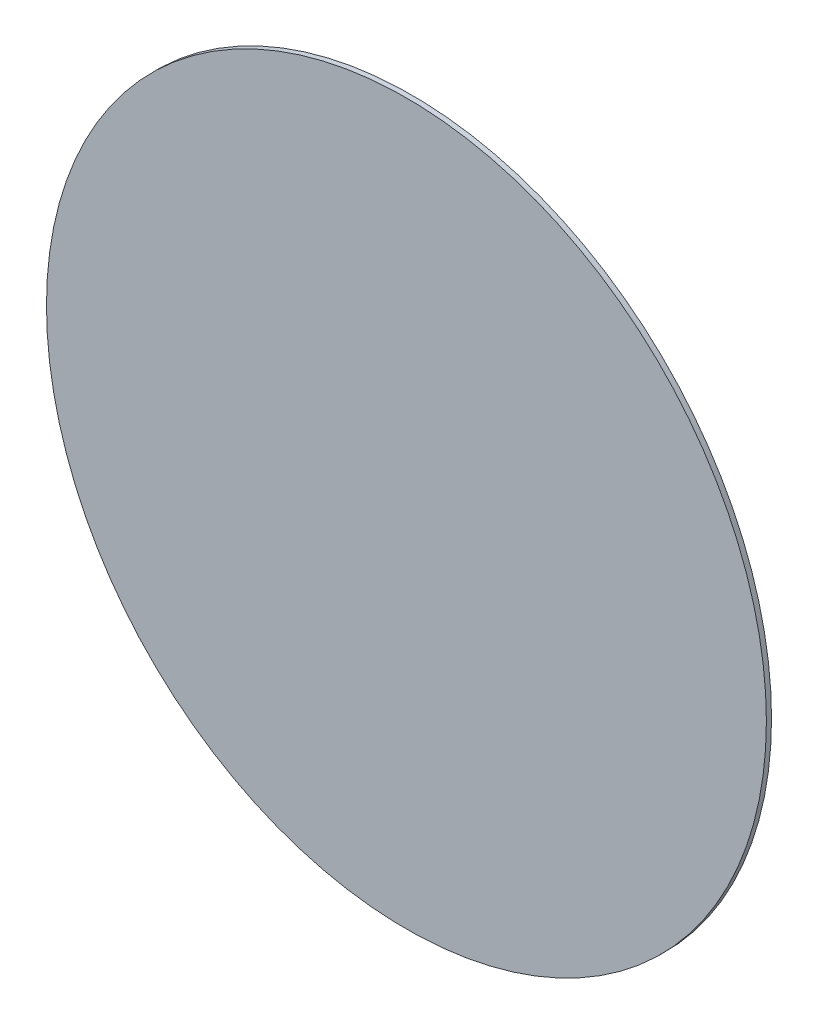
from build123d import *

# Parameters (mm, degrees)
SKETCH1_R           = 177.8
BOSS_EXTRUDE1_DEPTH = 2.54


with BuildPart() as part:
    # Sketch1 → Boss-Extrude1 (new body)
    with BuildSketch(Plane(origin=(0, 0, 0), x_dir=(0, 1, 0), z_dir=(0, 0, 1))):
        with Locations(Location((0, 0, 0), (0, 0, 270))):
            Circle(SKETCH1_R)
    extrude(amount=BOSS_EXTRUDE1_DEPTH)


solid = part.part
